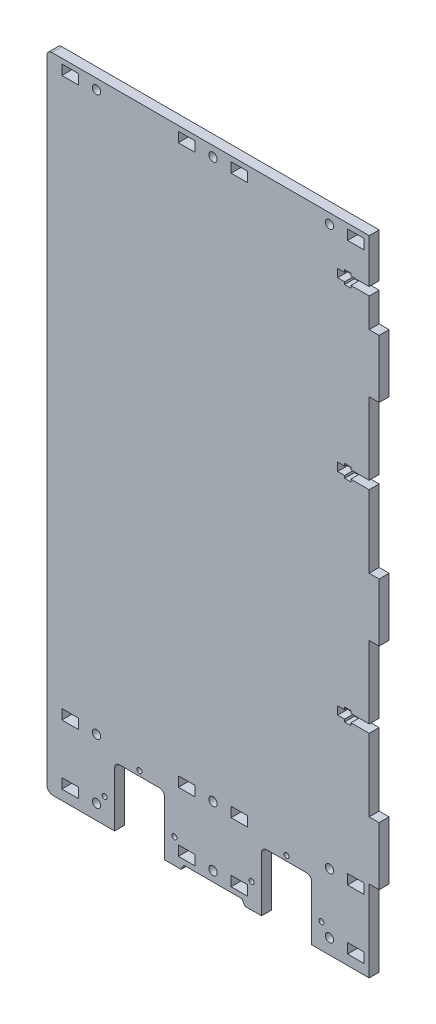
from build123d import *

# Parameters (mm, degrees)
SKETCH_1_R      = 2.5
SKETCH_1_R_2    = 1.5
SKETCH_1_W      = 10
SKETCH_1_H      = 6
EXTRUDE_1_DEPTH = 6
FILLET_1_R      = 3
FILLET_2_R      = 3.5


with BuildPart() as part:
    # Эскиз1 → Бобышка-Вытянуть1 (new body)
    with BuildSketch(Plane.XY):
        Polygon((-100, 9), (-100, -378), (-59.25, -378), (-59.25, -342), (-29.25, -342), (-29.25, -378), (-19.232050808, -378), (-17.5, -375), (17.5, -375), (19.232050808, -378), (29.25, -378), (29.25, -342), (59.25, -342), (59.25, -378), (94, -378), (94, -329), (100, -329), (100, -294), (94, -294), (94, -250.45), (83, -250.45), (83, -251.925), (79.2, -251.925), (79.2, -250.45), (75, -250.45), (75, -245.55), (79.2, -245.55), (79.2, -244.075), (83, -244.075), (83, -245.55), (94, -245.55), (94, -202), (100, -202), (100, -167), (94, -167), (94, -123.45), (83, -123.45), (83, -124.925), (79.2, -124.925), (79.2, -123.45), (75, -123.45), (75, -118.55), (79.2, -118.55), (79.2, -117.075), (83, -117.075), (83, -118.55), (94, -118.55), (94, -75), (100, -75), (100, -40), (94, -40), (94, -22.45), (83, -22.45), (83, -23.925), (79.2, -23.925), (79.2, -22.45), (75, -22.45), (75, -17.55), (79.2, -17.55), (79.2, -16.075), (83, -16.075), (83, -17.55), (94, -17.55), (94, 9), align=None)
        with Locations((-70.1375, 3)):
            Circle(SKETCH_1_R, mode=Mode.SUBTRACT)
        with Locations((0, 3)):
            Circle(SKETCH_1_R, mode=Mode.SUBTRACT)
        with Locations(Location((70.1375, 3, 0), (0, 0, 180))):
            Circle(SKETCH_1_R, mode=Mode.SUBTRACT)
        with Locations((-70.1375, -333)):
            Circle(SKETCH_1_R, mode=Mode.SUBTRACT)
        with Locations((0, -333)):
            Circle(SKETCH_1_R, mode=Mode.SUBTRACT)
        with Locations(Location((70.1375, -333, 0), (0, 0, 180))):
            Circle(SKETCH_1_R, mode=Mode.SUBTRACT)
        with Locations((-70.1375, -369)):
            Circle(SKETCH_1_R, mode=Mode.SUBTRACT)
        with Locations((0, -369)):
            Circle(SKETCH_1_R, mode=Mode.SUBTRACT)
        with Locations(Location((70.1375, -369, 0), (0, 0, 180))):
            Circle(SKETCH_1_R, mode=Mode.SUBTRACT)
        with Locations((-65.25, -363)):
            Circle(SKETCH_1_R_2, mode=Mode.SUBTRACT)
        with Locations((-44.25, -339)):
            Circle(SKETCH_1_R_2, mode=Mode.SUBTRACT)
        with Locations(Location((-23.25, -363, 0), (0, 0, 180))):
            Circle(SKETCH_1_R_2, mode=Mode.SUBTRACT)
        with Locations((23.25, -363)):
            Circle(SKETCH_1_R_2, mode=Mode.SUBTRACT)
        with Locations(Location((44.25, -339, 0), (0, 0, 180))):
            Circle(SKETCH_1_R_2, mode=Mode.SUBTRACT)
        with Locations(Location((65.25, -363, 0), (0, 0, 180))):
            Circle(SKETCH_1_R_2, mode=Mode.SUBTRACT)
        with Locations((86, 3)):
            Rectangle(SKETCH_1_W, SKETCH_1_H, mode=Mode.SUBTRACT)
        with Locations((15.8625, 3)):
            Rectangle(SKETCH_1_W, SKETCH_1_H, mode=Mode.SUBTRACT)
        with Locations((-15.8625, 3)):
            Rectangle(SKETCH_1_W, SKETCH_1_H, mode=Mode.SUBTRACT)
        with Locations((-86, 3)):
            Rectangle(SKETCH_1_W, SKETCH_1_H, mode=Mode.SUBTRACT)
        with Locations((86, -333)):
            Rectangle(SKETCH_1_W, SKETCH_1_H, mode=Mode.SUBTRACT)
        with Locations((15.8625, -333)):
            Rectangle(SKETCH_1_W, SKETCH_1_H, mode=Mode.SUBTRACT)
        with Locations((-15.8625, -333)):
            Rectangle(SKETCH_1_W, SKETCH_1_H, mode=Mode.SUBTRACT)
        with Locations((-86, -333)):
            Rectangle(SKETCH_1_W, SKETCH_1_H, mode=Mode.SUBTRACT)
        with Locations((86, -369)):
            Rectangle(SKETCH_1_W, SKETCH_1_H, mode=Mode.SUBTRACT)
        with Locations((15.8625, -369)):
            Rectangle(SKETCH_1_W, SKETCH_1_H, mode=Mode.SUBTRACT)
        with Locations((-15.8625, -369)):
            Rectangle(SKETCH_1_W, SKETCH_1_H, mode=Mode.SUBTRACT)
        with Locations((-86, -369)):
            Rectangle(SKETCH_1_W, SKETCH_1_H, mode=Mode.SUBTRACT)
    extrude(amount=EXTRUDE_1_DEPTH)

    # Скругление1
    fillet_1_edges = [part.edges().sort_by_distance(p)[0] for p in [
        (59.25, -342, 3),
        (29.25, -342, 3),
        (-29.25, -342, 3),
        (-59.25, -342, 3),
        (-100, 9, 3),
    ]]
    fillet(fillet_1_edges, radius=FILLET_1_R)

    # Скругление2
    fillet_2_edges = [part.edges().sort_by_distance(p)[0] for p in [
        (-100, -378, 3),
    ]]
    fillet(fillet_2_edges, radius=FILLET_2_R)


solid = part.part
